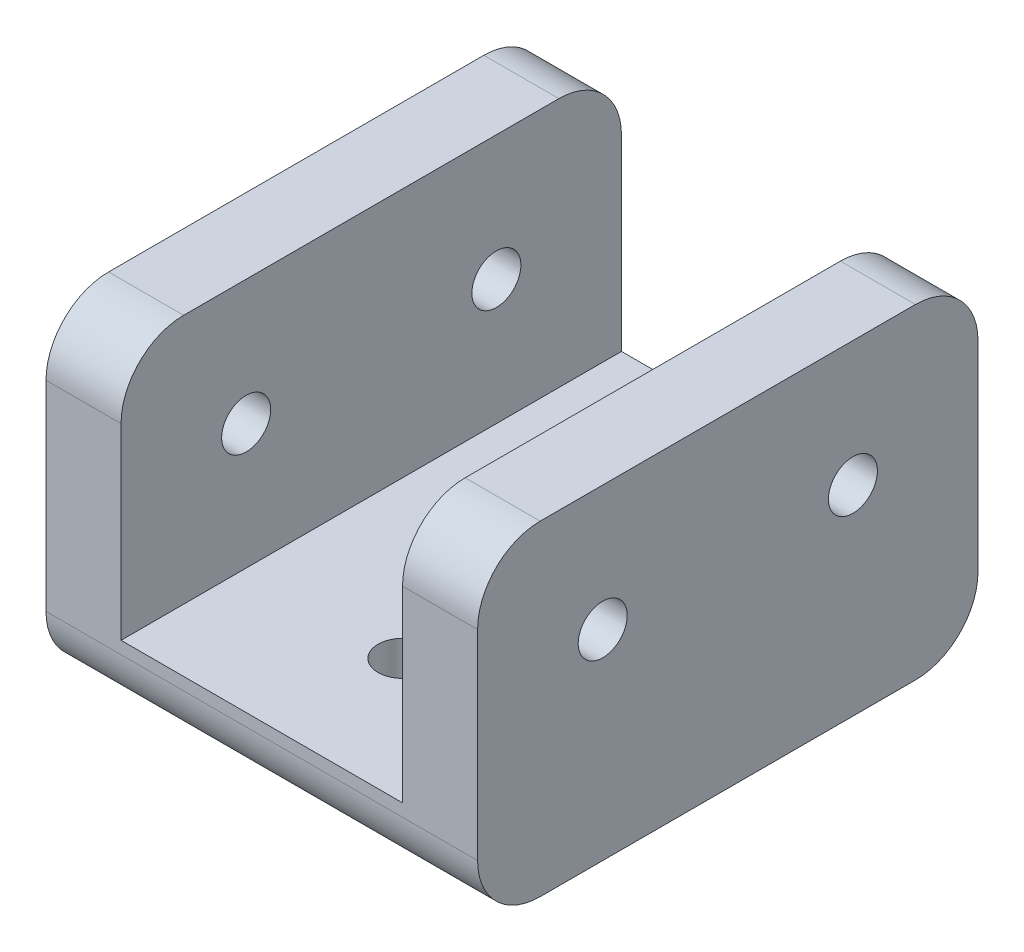
from build123d import *

# Parameters (mm, degrees)
BOSS_EXTRUDE1_DEPTH = 50.8
FILLET1_R           = 6.35
SKETCH2_R           = 2.4892
CUT_EXTRUDE1_DEPTH  = 75.771081475
SKETCH3_R           = 2.4892
CUT_EXTRUDE2_DEPTH  = 75.771081475


with BuildPart() as part:
    # Sketch1 → Boss-Extrude1 (new body)
    with BuildSketch(Plane.XY):
        Polygon((0, 33.02), (0, 0), (43.815, 0), (43.815, 33.02), (36.195, 33.02), (36.195, 7.62), (7.62, 7.62), (7.62, 33.02), align=None)
    extrude(amount=-BOSS_EXTRUDE1_DEPTH)

    # Fillet1
    fillet1_edges = [part.edges().sort_by_distance(p)[0] for p in [
        (21.9075, 0, 0),
        (3.81, 33.02, 0),
        (40.005, 33.02, 0),
        (3.81, 33.02, -50.8),
        (21.9075, 0, -50.8),
        (40.005, 33.02, -50.8),
    ]]
    fillet(fillet1_edges, radius=FILLET1_R)

    # Sketch2 → Cut-Extrude1 (cut, through all)
    with BuildSketch(Plane.ZY):
        with Locations((-38.1, 20.32)):
            Circle(SKETCH2_R)
        with Locations((-12.7, 20.32)):
            Circle(SKETCH2_R)
    extrude(amount=-CUT_EXTRUDE1_DEPTH, mode=Mode.SUBTRACT)

    # Sketch3 → Cut-Extrude2 (cut, through all)
    with BuildSketch(Plane.XZ):
        with Locations(Location((23.495, -38.1, 0), (0, 0, 270))):
            Circle(SKETCH3_R)
        with Locations(Location((23.495, -12.7, 0), (0, 0, 270))):
            Circle(SKETCH3_R)
    extrude(amount=-CUT_EXTRUDE2_DEPTH, mode=Mode.SUBTRACT)


solid = part.part
